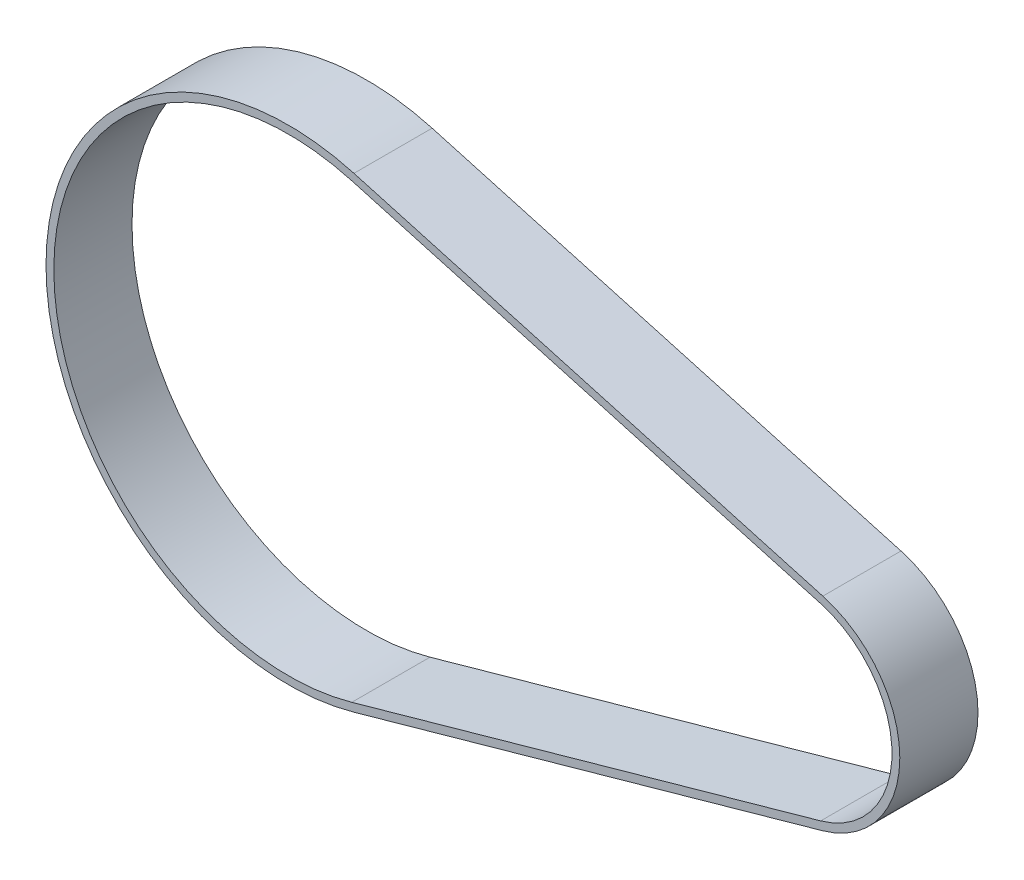
from build123d import *

# Parameters (mm, degrees)
EXTRUDE_1_DEPTH = 10


with BuildPart() as part:
    # 草图1 → 拉伸1 (new body)
    with BuildSketch(Plane.XY):
        with BuildLine():
            Line((3.651468315, 12.996798804), (-56.315146832, 29.844500957))
            ThreePointArc((-56.315146832, 29.844500957), (-95.7, 0), (-56.315146832, -29.844500957))
            Line((-56.315146832, -29.844500957), (3.651468315, -12.996798804))
            ThreePointArc((3.651468315, -12.996798804), (13.5, 0), (3.651468315, 12.996798804))
        make_face()
        with BuildLine():
            Line((3.380989181, 12.034072966), (-56.585625966, 28.881775119))
            ThreePointArc((-56.585625966, 28.881775119), (-94.7, 0), (-56.585625966, -28.881775119))
            Line((-56.585625966, -28.881775119), (3.380989181, -12.034072966))
            ThreePointArc((3.380989181, -12.034072966), (12.5, 0), (3.380989181, 12.034072966))
        make_face(mode=Mode.SUBTRACT)
    extrude(amount=EXTRUDE_1_DEPTH)


solid = part.part
